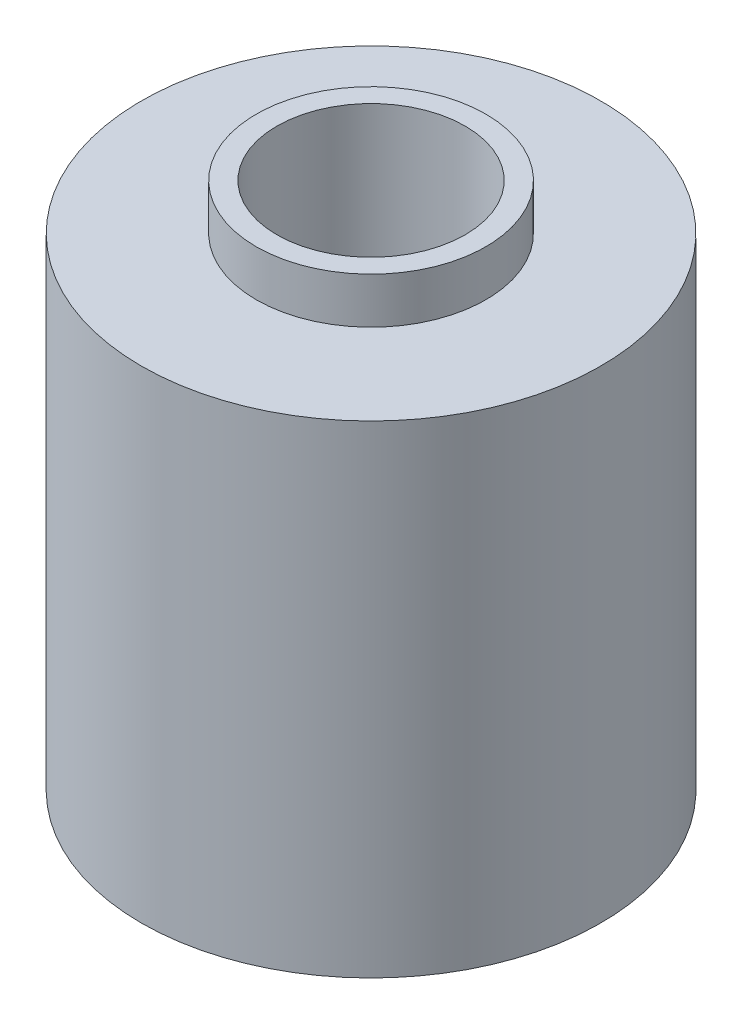
from build123d import *


with BuildPart() as part:
    # Sketch1 → Revolve1 (revolve)
    with BuildSketch(Plane(origin=(0, 0, 0), x_dir=(0, 0, -1), z_dir=(1, 0, 0)), mode=Mode.PRIVATE) as revolve1_sk:
        Polygon((4.1, 12.5), (4.1, -12.5), (5, -12.5), (5, -10.5), (10, -10.5), (10, 10.5), (5, 10.5), (5, 12.5), align=None)
    revolve(revolve1_sk.sketch.rotate(Axis((0, 30.434615385, 0), (0, -1, 0)), 180), axis=Axis((0, 30.434615385, 0), (0, -1, 0)))


solid = part.part
